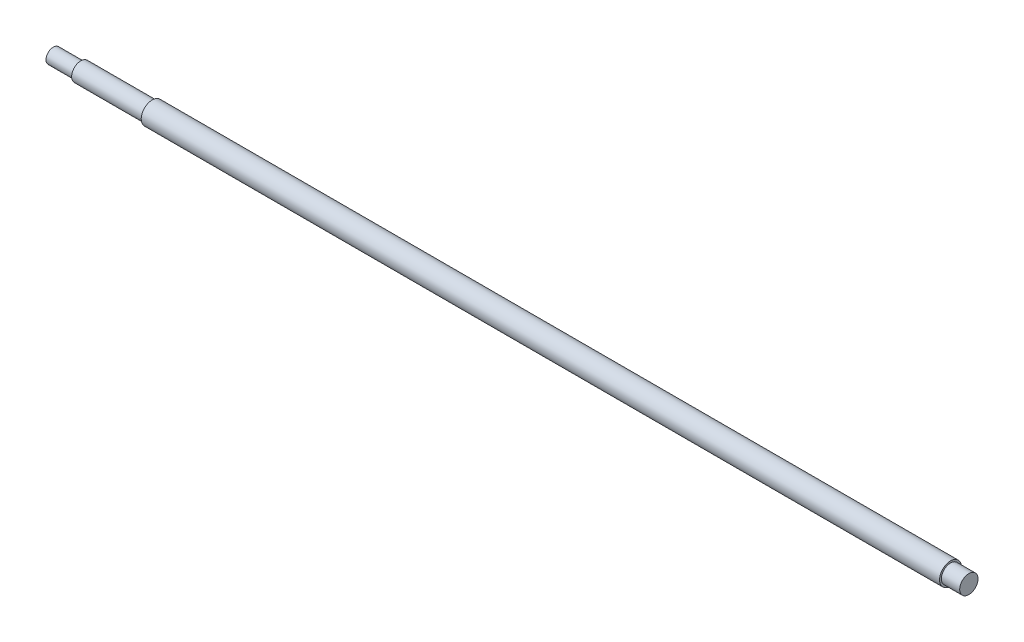
from build123d import *


with BuildPart() as part:
    # Эскиз1 → Повернуть1 (revolve)
    with BuildSketch(Plane.XY):
        Polygon((0, 0), (0, 5), (-10, 5), (-10, 6), (-446, 6), (-446, 5), (-485, 5), (-485, 4), (-500, 4), (-500, 0), align=None)
    revolve(axis=Axis((0, 0, 0), (-1, 0, 0)))


solid = part.part
